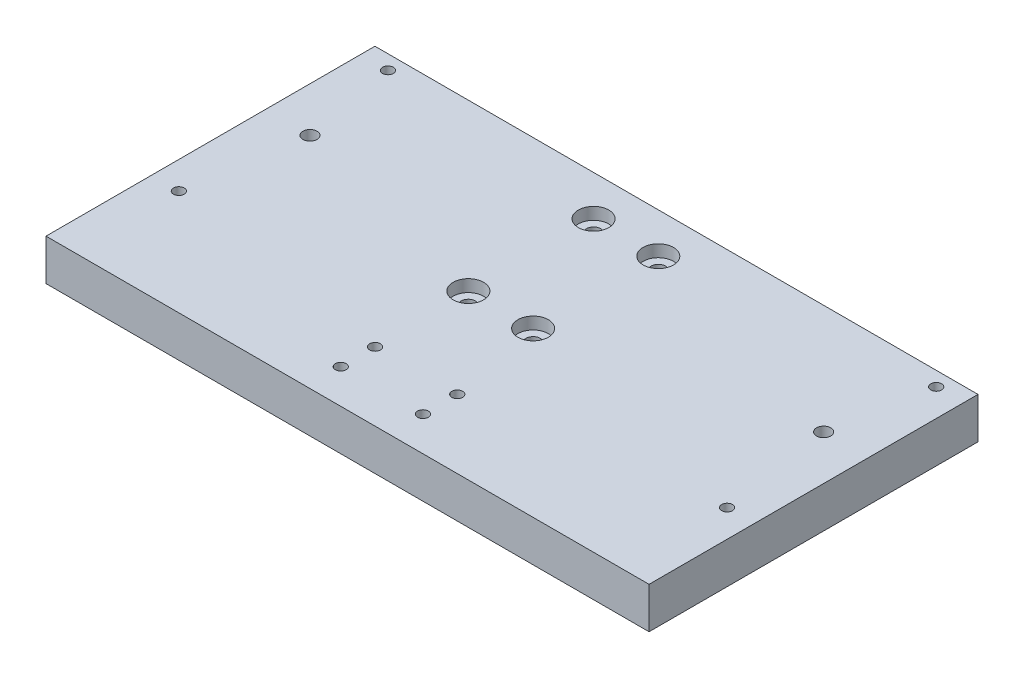
from build123d import *

# Parameters (mm, degrees)
SKETCH1_W           = 139.7
SKETCH1_H           = 50.8
BOSS_EXTRUDE1_DEPTH = 9.525
SKETCH13_W          = 139.7
SKETCH13_H          = 9.525
BOSS_EXTRUDE2_DEPTH = 25.4
SKETCH45_R          = 2.77495
CUT_EXTRUDE3_DEPTH  = 2.79908
SKETCH47_R          = 1.25
CUT_EXTRUDE4_DEPTH  = 87.892969365
SKETCH2_R           = 1.65
CUT_EXTRUDE5_DEPTH  = 87.892969365
SKETCH50_R          = 3.52552
CUT_EXTRUDE6_DEPTH  = 2.79908
SKETCH51_R          = 1.25
CUT_EXTRUDE10_DEPTH = 87.892969365
SKETCH35_R          = 1.25
CUT_EXTRUDE11_DEPTH = 87.892969365


with BuildPart() as part:
    # Sketch1 → Boss-Extrude1 (new body)
    with BuildSketch(Plane(origin=(0, 0, 0), x_dir=(1, 0, 0), z_dir=(0, 1, 0))):
        Rectangle(SKETCH1_W, SKETCH1_H)
    extrude(amount=BOSS_EXTRUDE1_DEPTH)

    # Sketch13 → Boss-Extrude2 (add)
    with BuildSketch(Plane.XY.offset(25.4)):
        with Locations((0, 4.7625)):
            Rectangle(SKETCH13_W, SKETCH13_H)
    extrude(amount=BOSS_EXTRUDE2_DEPTH)

    # Sketch45 → Cut-Extrude3 (cut)
    with BuildSketch(Plane.XZ):
        with Locations(Location((63.5, 26.37536, 0), (0, 0, 270))):
            Circle(SKETCH45_R)
        with Locations(Location((-63.5, 26.37536, 0), (0, 0, 270))):
            Circle(SKETCH45_R)
    extrude(amount=-CUT_EXTRUDE3_DEPTH, mode=Mode.SUBTRACT)

    # Sketch47 → Cut-Extrude4 (cut, through all)
    with BuildSketch(Plane.XZ):
        with Locations(Location((63.5, 26.37536, 0), (0, 0, 270))):
            Circle(SKETCH47_R)
        with Locations(Location((-63.5, 26.37536, 0), (0, 0, 270))):
            Circle(SKETCH47_R)
    extrude(amount=-CUT_EXTRUDE4_DEPTH, mode=Mode.SUBTRACT)

    # Sketch2 → Cut-Extrude5 (cut, through all)
    with BuildSketch(Plane(origin=(0, 9.525, 0), x_dir=(1, 0, 0), z_dir=(0, 1, 0))):
        with Locations(Location((-9.906, 16.1, 0), (0, 0, 270))):
            Circle(SKETCH2_R)
        with Locations(Location((5.094, 16.1, 0), (0, 0, 270))):
            Circle(SKETCH2_R)
        with Locations(Location((-9.906, -12.9, 0), (0, 0, 270))):
            Circle(SKETCH2_R)
        with Locations(Location((5.094, -12.9, 0), (0, 0, 270))):
            Circle(SKETCH2_R)
        with Locations(Location((-59.5, 0, 0), (0, 0, 270))):
            Circle(SKETCH2_R)
        with Locations(Location((59.5, 0, 0), (0, 0, 270))):
            Circle(SKETCH2_R)
    extrude(amount=-CUT_EXTRUDE5_DEPTH, mode=Mode.SUBTRACT)

    # Sketch50 → Cut-Extrude6 (cut)
    with BuildSketch(Plane(origin=(0, 9.525, 0), x_dir=(1, 0, 0), z_dir=(0, 1, 0))):
        with Locations(Location((-9.906, 16.1, 0), (0, 0, 270))):
            Circle(SKETCH50_R)
        with Locations(Location((5.094, 16.1, 0), (0, 0, 270))):
            Circle(SKETCH50_R)
        with Locations(Location((5.094, -12.9, 0), (0, 0, 270))):
            Circle(SKETCH50_R)
        with Locations(Location((-9.906, -12.9, 0), (0, 0, 270))):
            Circle(SKETCH50_R)
    extrude(amount=-CUT_EXTRUDE6_DEPTH, mode=Mode.SUBTRACT)

    # Sketch51 → Cut-Extrude10 (cut, through all)
    with BuildSketch(Plane(origin=(0, 9.525, 0), x_dir=(1, 0, 0), z_dir=(0, 1, 0))):
        with Locations(Location((-63.5, 22.06371, 0), (0, 0, 270))):
            Circle(SKETCH51_R)
        with Locations(Location((63.5, 22.06371, 0), (0, 0, 270))):
            Circle(SKETCH51_R)
    extrude(amount=-CUT_EXTRUDE10_DEPTH, mode=Mode.SUBTRACT)

    # Sketch35 → Cut-Extrude11 (cut, through all)
    with BuildSketch(Plane(origin=(0, 0, 0), x_dir=(1, 0, 0), z_dir=(0, 1, 0))):
        with Locations(Location((9.525, -34.9, 0), (0, 0, 90))):
            Circle(SKETCH35_R)
        with Locations(Location((-9.525, -34.9, 0), (0, 0, 90))):
            Circle(SKETCH35_R)
        with Locations(Location((-9.525, -42.85, 0), (0, 0, 90))):
            Circle(SKETCH35_R)
        with Locations(Location((9.525, -42.85, 0), (0, 0, 90))):
            Circle(SKETCH35_R)
    extrude(amount=CUT_EXTRUDE11_DEPTH, mode=Mode.SUBTRACT)


solid = part.part
